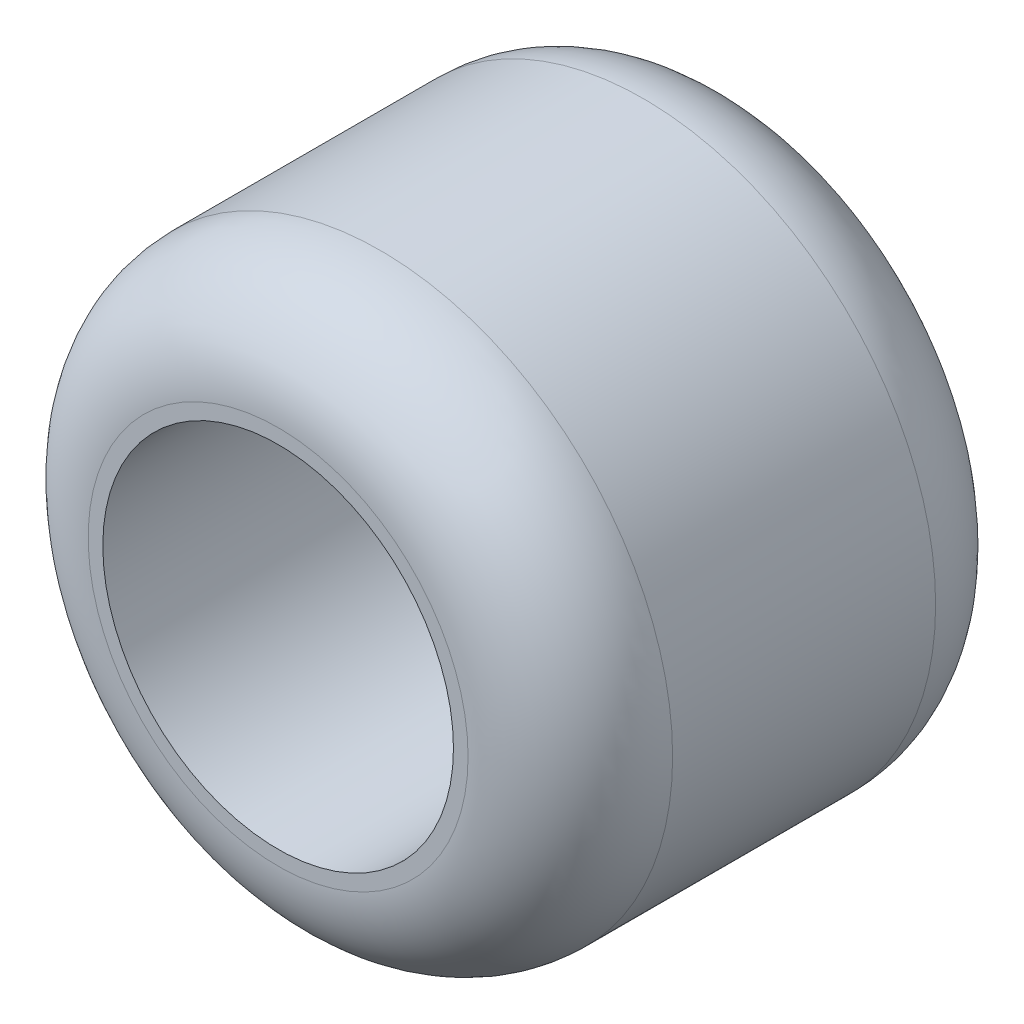
from build123d import *

# Parameters (mm, degrees)
SKETCH1_R           = 5
BOSS_EXTRUDE1_DEPTH = 8
SKETCH2_R           = 3
CUT_EXTRUDE1_DEPTH  = 8
FILLET1_R           = 1.75


with BuildPart() as part:
    # Sketch1 → Boss-Extrude1 (new body)
    with BuildSketch(Plane.XY):
        Circle(SKETCH1_R)
    extrude(amount=BOSS_EXTRUDE1_DEPTH)

    # Sketch2 → Cut-Extrude1 (cut)
    with BuildSketch(Plane.XY.offset(8)):
        Circle(SKETCH2_R)
    extrude(amount=-CUT_EXTRUDE1_DEPTH, mode=Mode.SUBTRACT)

    # Fillet1
    fillet1_edges = [part.edges().sort_by_distance(p)[0] for p in [
        (-5, 0, 0),
        (-5, 0, 8),
    ]]
    fillet(fillet1_edges, radius=FILLET1_R)


solid = part.part
